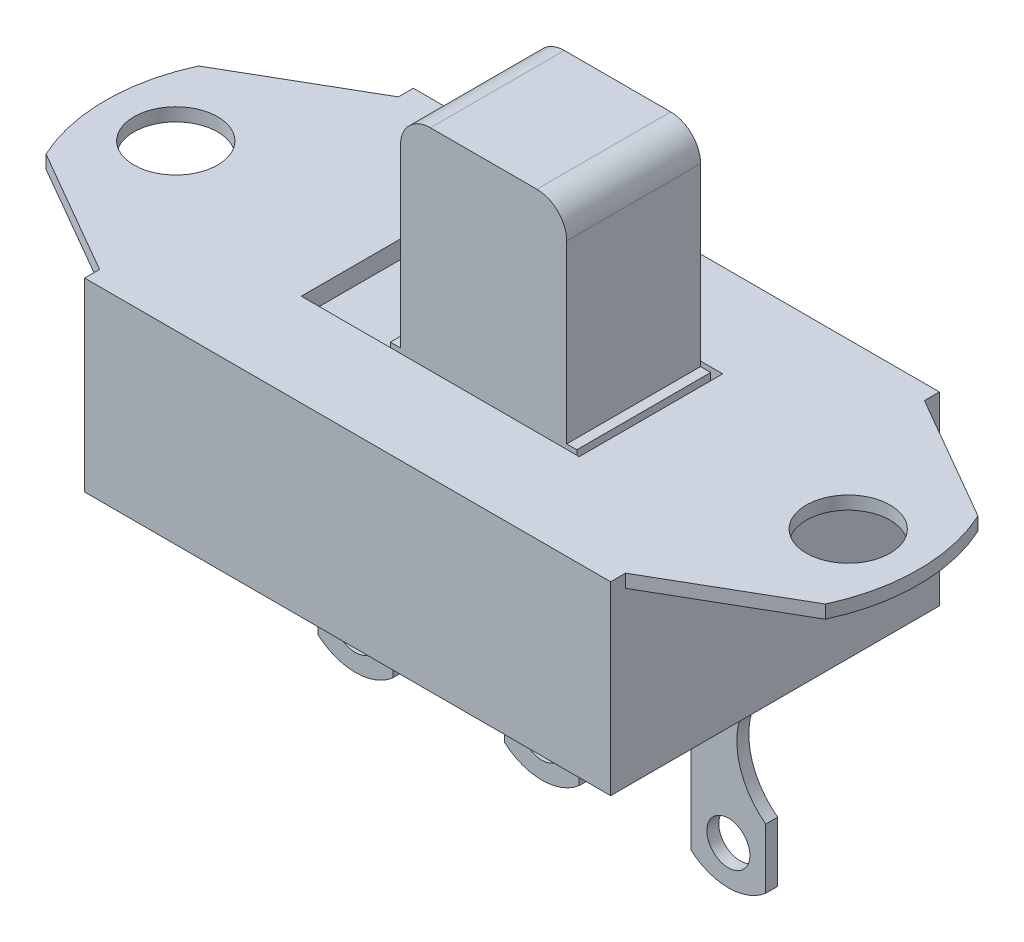
from build123d import *

# Parameters (mm, degrees)
SKETCH1_W       = 22.352
SKETCH1_H       = 7.874
EXTRUDE1_DEPTH  = 6.985
EXTRUDE2_DEPTH  = 0.5588
SKETCH3_W       = 11.811
SKETCH3_H       = 6.096
EXTRUDE3_DEPTH  = 0.762
SKETCH4_W       = 7.0612
SKETCH4_H       = 5.6896
EXTRUDE4_DEPTH  = 9.4996
SKETCH7_W       = 7.9248
SKETCH7_H       = 5.6896
EXTRUDE7_DEPTH  = 0.762
FILLET2_R       = 1.27
SKETCH5_R       = 1.778
EXTRUDE5_DEPTH  = 9.4996
SKETCH6_R       = 0.9144
EXTRUDE6_DEPTH  = 0.508
LPATTERN1_COUNT = 2
LPATTERN1_PITCH = 7.9248
LPATTERN2_COUNT = 2
LPATTERN2_PITCH = 7.9248


with BuildPart() as part:
    # Sketch1 → Extrude1 (new, symmetric)
    with BuildSketch(Plane.XY):
        with Locations((11.176, 3.937)):
            Rectangle(SKETCH1_W, SKETCH1_H)
    extrude(amount=EXTRUDE1_DEPTH, both=True)

    # Sketch2 → Extrude2 (add)
    with BuildSketch(Plane(origin=(0, 7.874, 0), x_dir=(1, 0, 0), z_dir=(0, 1, 0))):
        with BuildLine():
            Line((0, 6.35), (-5.3848, 3.24108427))
            ThreePointArc((-5.3848, 3.24108427), (-6.096, 0), (-5.3848, -3.24108427))
            Line((-5.3848, -3.24108427), (0, -6.35))
            Line((0, -6.35), (0, 6.35))
        make_face()
        with BuildLine():
            Line((22.352, 6.35), (22.352, -6.35))
            Line((22.352, -6.35), (27.7368, -3.24108427))
            ThreePointArc((27.7368, -3.24108427), (28.448, 0), (27.7368, 3.24108427))
            Line((27.7368, 3.24108427), (22.352, 6.35))
        make_face()
    extrude(amount=-EXTRUDE2_DEPTH)

    # Sketch3 → Extrude3 (cut)
    with BuildSketch(Plane(origin=(0, 7.874, 0), x_dir=(1, 0, 0), z_dir=(0, 1, 0))):
        with Locations((11.176, 0)):
            Rectangle(SKETCH3_W, SKETCH3_H)
    extrude(amount=-EXTRUDE3_DEPTH, mode=Mode.SUBTRACT)

    # Sketch4 → Extrude4 (add)
    with BuildSketch(Plane(origin=(0, 7.112, 0), x_dir=(1, 0, 0), z_dir=(0, 1, 0))):
        with Locations((12.8143, 0)):
            Rectangle(SKETCH4_W, SKETCH4_H)
    extrude(amount=EXTRUDE4_DEPTH)

    # Sketch7 → Extrude7 (add)
    with BuildSketch(Plane(origin=(0, 7.874, 0), x_dir=(1, 0, 0), z_dir=(0, 1, 0))):
        with Locations((12.8143, 0)):
            Rectangle(SKETCH7_W, SKETCH7_H)
    extrude(amount=-EXTRUDE7_DEPTH)

    # Fillet2
    fillet2_edges = [part.edges().sort_by_distance(p)[0] for p in [
        (9.2837, 16.6116, 0),
        (16.3449, 16.6116, 0),
    ]]
    fillet(fillet2_edges, radius=FILLET2_R)

    # Sketch5 → Extrude5 (cut)
    with BuildSketch(Plane(origin=(0, 7.874, 0), x_dir=(1, 0, 0), z_dir=(0, 1, 0))):
        with Locations(Location((-3.1115, 0, 0), (0, 0, 270))):
            Circle(SKETCH5_R)
        with Locations(Location((25.4635, 0, 0), (0, 0, 270))):
            Circle(SKETCH5_R)
    extrude(amount=-EXTRUDE5_DEPTH, mode=Mode.SUBTRACT)

    # Sketch6 → Extrude6 (add)
    with BuildSketch(Plane.XY.offset(-1.27)):
        with BuildLine():
            Line((12.7635, -6.00209581), (12.7635, -8.548254179))
            ThreePointArc((12.7635, -8.548254179), (11.176, -9.144), (9.5885, -8.548254179))
            Line((9.5885, -8.548254179), (9.5885, 0))
            Line((9.5885, 0), (12.7635, 0))
            Line((12.7635, 0), (12.7635, -1.10990419))
            ThreePointArc((12.7635, -1.10990419), (11.533993687, -3.556), (12.7635, -6.00209581))
        make_face()
        with Locations((11.176, -7.493)):
            Circle(SKETCH6_R, mode=Mode.SUBTRACT)
    extrude6 = extrude(amount=-EXTRUDE6_DEPTH)

    # LPattern1: Extrude6 ×2
    with Locations(*[(i * LPATTERN1_PITCH, 0, 0) for i in range(1, LPATTERN1_COUNT)]):
        add(extrude6)

    # LPattern2: Extrude6 ×2
    with Locations(*[(-i * LPATTERN2_PITCH, 0, 0) for i in range(1, LPATTERN2_COUNT)]):
        add(extrude6)


solid = part.part
